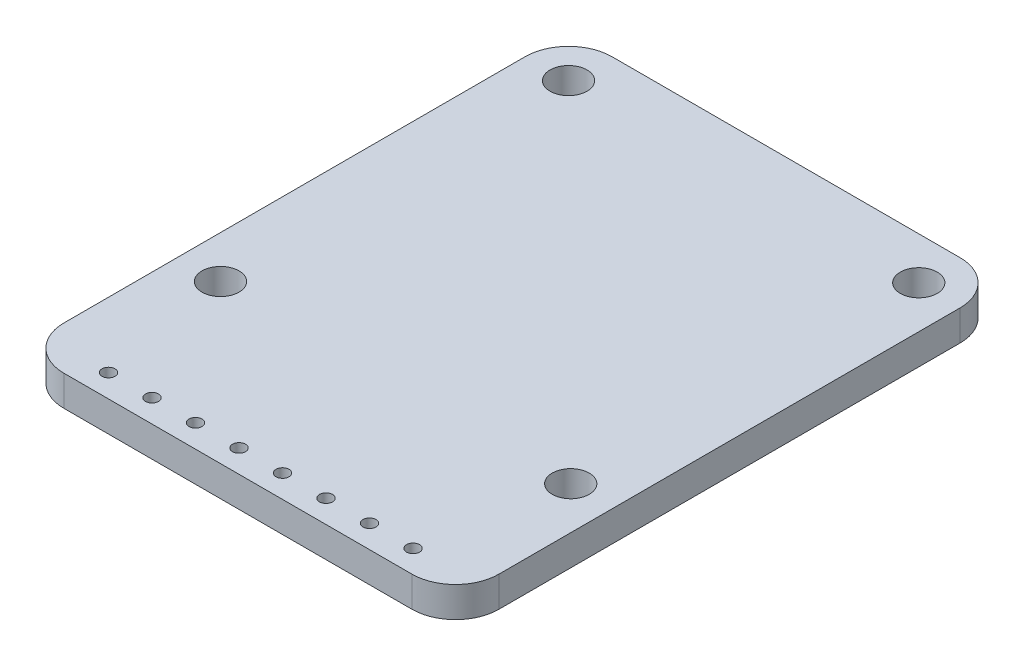
from build123d import *

# Parameters (mm, degrees)
SKETCH1_R           = 1.0795
BOSS_EXTRUDE1_DEPTH = 1.778
SKETCH2_W           = 13.208
SKETCH2_H           = 2.667
BOSS_EXTRUDE2_DEPTH = 2.159
SKETCH3_R           = 0.381
CUT_EXTRUDE1_DEPTH  = 21.805142946
SKETCH4_W           = 13.766930462
SKETCH4_H           = 3.870443226
CUT_EXTRUDE2_DEPTH  = 31.097928251
SKETCH5_W           = 0.284935897
SKETCH5_H           = 2.320192307
SKETCH5_W_2         = 1.221153846
SKETCH5_H_2         = 0.325641026
CUT_EXTRUDE3_DEPTH  = 0.0254
SKETCH9_W           = 14.097
SKETCH9_H           = 15.24
BOSS_EXTRUDE4_DEPTH = 1.524


with BuildPart() as part:
    # Sketch1 → Boss-Extrude1 (new body)
    with BuildSketch(Plane(origin=(0, 0, 0), x_dir=(1, 0, 0), z_dir=(0, 1, 0))):
        with BuildLine():
            Line((10.16, 16.002), (-10.16, 16.002))
            ThreePointArc((-10.16, 16.002), (-11.956051224, 15.258051224), (-12.7, 13.462))
            Line((-12.7, 13.462), (-12.7, -13.462))
            ThreePointArc((-12.7, -13.462), (-11.956051224, -15.258051224), (-10.16, -16.002))
            Line((-10.16, -16.002), (10.16, -16.002))
            ThreePointArc((10.16, -16.002), (11.956051224, -15.258051224), (12.7, -13.462))
            Line((12.7, -13.462), (12.7, 13.462))
            ThreePointArc((12.7, 13.462), (11.956051224, 15.258051224), (10.16, 16.002))
        make_face()
        with Locations(Location((-10.2235, 13.5255, 0), (0, 0, 270))):
            Circle(SKETCH1_R, mode=Mode.SUBTRACT)
        with Locations(Location((10.2235, 13.5255, 0), (0, 0, 270))):
            Circle(SKETCH1_R, mode=Mode.SUBTRACT)
        with Locations(Location((-10.2235, -6.7945, 0), (0, 0, 270))):
            Circle(SKETCH1_R, mode=Mode.SUBTRACT)
        with Locations(Location((10.2235, -6.7945, 0), (0, 0, 270))):
            Circle(SKETCH1_R, mode=Mode.SUBTRACT)
    extrude(amount=BOSS_EXTRUDE1_DEPTH)

    # Sketch2 → Boss-Extrude2 (add)
    with BuildSketch(Plane.XZ):
        with Locations((0, 14.6685)):
            Rectangle(SKETCH2_W, SKETCH2_H)
    extrude(amount=BOSS_EXTRUDE2_DEPTH)

    # Sketch3 → Cut-Extrude1 (cut, through all)
    with BuildSketch(Plane.XZ.offset(2.159)):
        with Locations(Location((-8.89, 14.6685, 0), (0, 0, 270))):
            Circle(SKETCH3_R)
        with Locations(Location((-6.35, 14.6685, 0), (0, 0, 270))):
            Circle(SKETCH3_R)
        with Locations(Location((-3.81, 14.6685, 0), (0, 0, 270))):
            Circle(SKETCH3_R)
        with Locations(Location((6.35, 14.6685, 0), (0, 0, 270))):
            Circle(SKETCH3_R)
        with Locations(Location((8.89, 14.6685, 0), (0, 0, 270))):
            Circle(SKETCH3_R)
        with Locations(Location((-1.27, 14.6685, 0), (0, 0, 270))):
            Circle(SKETCH3_R)
        with Locations(Location((1.27, 14.6685, 0), (0, 0, 270))):
            Circle(SKETCH3_R)
        with Locations(Location((3.81, 14.6685, 0), (0, 0, 270))):
            Circle(SKETCH3_R)
    extrude(amount=-CUT_EXTRUDE1_DEPTH, mode=Mode.SUBTRACT)

    # Sketch4 → Cut-Extrude2 (cut, through all)
    with BuildSketch(Plane.ZY.offset(12.7)):
        with Locations((10.251270415, -1.935221613)):
            Rectangle(SKETCH4_W, SKETCH4_H)
    extrude(amount=-CUT_EXTRUDE2_DEPTH, mode=Mode.SUBTRACT)

    # Sketch5 → Cut-Extrude3 (cut)
    # profile 1 of 9: a face of its own
    with BuildSketch(Plane.XZ):
        Polygon((-9.854352926, 0.17008141), (-9.435217309, 3.34508141), (-9.394512181, 3.34508141), (-8.083679849, 0.739953204), (-6.776027605, 3.34508141), (-6.73468646, 3.34508141), (-6.313006772, 0.17008141), (-6.599214705, 0.17008141), (-6.903231131, 2.45465673), (-8.049334897, 0.17008141), (-8.113572677, 0.17008141), (-9.264128567, 2.459744871), (-9.567508976, 0.17008141), align=None)
    # profile 2 of 9: a face of its own
    with BuildSketch(Plane.XZ):
        with BuildLine():
            add(Edge.make_bspline(
                [(-5.642644192, 3.467196794), (-5.624962784, 3.466376599), (-5.590339191, 3.464770499), (-5.540271013, 3.451016873), (-5.494680723, 3.427703587), (-5.454242351, 3.396425591), (-5.419542426, 3.359641453), (-5.395248495, 3.316769003), (-5.379634393, 3.270451523), (-5.377748847, 3.23814355), (-5.376788823, 3.22169399)],
                knots=[0, 0, 0, 0, 1.055194115, 2.066272739, 3.074728998, 4.095836921, 5.109056067, 6.073838105, 7.019297344, 8, 8, 8, 8], degree=3))
            add(Edge.make_bspline(
                [(-5.376788823, 3.22169399), (-5.377770497, 3.20567144), (-5.379711149, 3.173996756), (-5.395236435, 3.128482249), (-5.419749465, 3.086205506), (-5.454220101, 3.04949279), (-5.494686619, 3.018232085), (-5.540269447, 2.994914215), (-5.590339603, 2.981161804), (-5.624962923, 2.979555537), (-5.642644192, 2.978735256)],
                knots=[0, 0, 0, 0, 0.96129708, 1.900370562, 2.859976407, 3.87933698, 4.906634145, 5.921202961, 6.938410037, 8, 8, 8, 8], degree=3))
            add(Edge.make_bspline(
                [(-5.642644192, 2.978735256), (-5.66012327, 2.979524216), (-5.694144012, 2.981059825), (-5.743462505, 2.995184055), (-5.788664063, 3.018240064), (-5.829181302, 3.049288104), (-5.862954406, 3.086430975), (-5.887536458, 3.128456448), (-5.903025888, 3.174003324), (-5.904971372, 3.205673647), (-5.90595549, 3.22169399)],
                knots=[0, 0, 0, 0, 1.054934014, 2.053291228, 3.073705704, 4.106921865, 5.123545215, 6.088680038, 7.033164197, 8, 8, 8, 8], degree=3))
            add(Edge.make_bspline(
                [(-5.90595549, 3.22169399), (-5.904992933, 3.23814126), (-5.90310241, 3.270444738), (-5.887524847, 3.316795232), (-5.863159165, 3.359414166), (-5.829158939, 3.396630155), (-5.788670014, 3.427695656), (-5.743460967, 3.450747046), (-5.694144418, 3.464872476), (-5.660123408, 3.466407919), (-5.642644192, 3.467196794)],
                knots=[0, 0, 0, 0, 0.98631895, 1.937192651, 2.907499808, 3.917963147, 4.944918757, 5.95915025, 6.951458133, 8, 8, 8, 8], degree=3))
        make_face()
    # profile 3 of 9: a face of its own
    with BuildSketch(Plane.XZ):
        with Locations((-5.641372157, 1.330177563)):
            Rectangle(SKETCH5_W, SKETCH5_H)
    # profile 4 of 9: a face of its own
    with BuildSketch(Plane.XZ):
        with BuildLine():
            Line((-2.527429849, 1.987183773), (-2.76593646, 1.838991666))
            add(Edge.make_bspline(
                [(-2.76593646, 1.838991666), (-2.792089266, 1.871493138), (-2.843566625, 1.935466766), (-2.93295579, 2.018025777), (-3.028216144, 2.088934451), (-3.130975516, 2.146722853), (-3.241089777, 2.19137374), (-3.358124678, 2.222969713), (-3.482063529, 2.242658561), (-3.567031245, 2.244896335), (-3.61056787, 2.246042948)],
                knots=[0, 0, 0, 0, 1.026593902, 2.0206758, 2.988051866, 3.946915611, 4.916868779, 5.907761954, 6.927957743, 8, 8, 8, 8], degree=3))
            add(Edge.make_bspline(
                [(-3.61056787, 2.246042948), (-3.645364924, 2.245084241), (-3.713896775, 2.243196094), (-3.8145045, 2.231393718), (-3.910337206, 2.209947039), (-4.001995563, 2.181688671), (-4.088827657, 2.143815194), (-4.17106099, 2.097723487), (-4.24942497, 2.044156664), (-4.321648729, 1.982098527), (-4.387715042, 1.914608307), (-4.444954771, 1.842260312), (-4.494790418, 1.767221553), (-4.533893678, 1.687618187), (-4.565893297, 1.605271339), (-4.586945108, 1.518626627), (-4.600973796, 1.428794077), (-4.60257883, 1.367545297), (-4.603391387, 1.33653774)],
                knots=[0, 0, 0, 0, 1.112346261, 2.190735716, 3.231507886, 4.247384806, 5.251966152, 6.253067467, 7.256802811, 8.280671706, 9.291813951, 10.270744147, 11.225547591, 12.165006084, 13.100104208, 14.043489273, 15.009504848, 16, 16, 16, 16], degree=3))
            add(Edge.make_bspline(
                [(-4.603391387, 1.33653774), (-4.601777351, 1.29592567), (-4.598571027, 1.215248742), (-4.573441846, 1.09616075), (-4.532307991, 0.981022831), (-4.476012655, 0.870652449), (-4.404822683, 0.768513465), (-4.321209001, 0.676907046), (-4.225125261, 0.59760822), (-4.117418075, 0.531865287), (-4.000616408, 0.479013904), (-3.875983956, 0.441360823), (-3.744539155, 0.418634742), (-3.654544463, 0.415771851), (-3.608659817, 0.414312179)],
                knots=[0, 0, 0, 0, 0.966302908, 1.919585723, 2.883856336, 3.870342332, 4.860282998, 5.839159637, 6.814385684, 7.815993281, 8.834850808, 9.858348828, 10.908058873, 12, 12, 12, 12], degree=3))
            add(Edge.make_bspline(
                [(-3.608659817, 0.414312179), (-3.566609042, 0.415491008), (-3.483968112, 0.417807721), (-3.36316636, 0.437337567), (-3.24815887, 0.469308577), (-3.138949728, 0.513892517), (-3.035738492, 0.571521049), (-2.939192026, 0.642604011), (-2.847389225, 0.725096499), (-2.793416967, 0.788884944), (-2.76593646, 0.821363461)],
                knots=[0, 0, 0, 0, 1.039848629, 2.043578496, 3.018386758, 3.987534228, 4.954977003, 5.934852016, 6.948509513, 8, 8, 8, 8], degree=3))
            Line((-2.76593646, 0.821363461), (-2.527429849, 0.664903124))
            add(Edge.make_bspline(
                [(-2.527429849, 0.664903124), (-2.541570122, 0.644137965), (-2.569803734, 0.602676568), (-2.617000223, 0.544216548), (-2.667908927, 0.489496165), (-2.722331236, 0.438588768), (-2.779556538, 0.390276136), (-2.841539713, 0.346867922), (-2.906282147, 0.30592419), (-2.974543882, 0.269082513), (-3.045619159, 0.235966065), (-3.119407963, 0.207489788), (-3.195589651, 0.183024049), (-3.274253792, 0.163577313), (-3.355555471, 0.148055339), (-3.439284425, 0.137755909), (-3.525411817, 0.130067618), (-3.583625126, 0.129608725), (-3.61311194, 0.129376281)],
                knots=[0, 0, 0, 0, 0.954134338, 1.905101784, 2.851144739, 3.791306361, 4.734911809, 5.6936923, 6.663572882, 7.643865596, 8.638447847, 9.640600242, 10.646758161, 11.676244097, 12.717260333, 13.78922464, 14.880174919, 16, 16, 16, 16], degree=3))
            add(Edge.make_bspline(
                [(-3.61311194, 0.129376281), (-3.658116099, 0.1301848), (-3.746324577, 0.131769501), (-3.875431423, 0.149194332), (-3.99881525, 0.175463027), (-4.116433903, 0.213167271), (-4.228305694, 0.261703746), (-4.334326309, 0.320991804), (-4.434144696, 0.391523785), (-4.526773764, 0.472044297), (-4.611846933, 0.559348307), (-4.684895691, 0.653555018), (-4.748255329, 0.751200826), (-4.799134744, 0.854442325), (-4.839635884, 0.961907341), (-4.867308125, 1.074456773), (-4.885205816, 1.191162747), (-4.887277167, 1.270749004), (-4.888327285, 1.311097035)],
                knots=[0, 0, 0, 0, 1.1129367, 2.181364009, 3.217532258, 4.231199276, 5.232079859, 6.230262199, 7.231623845, 8.250719726, 9.263571943, 10.242672461, 11.195837495, 12.138959767, 13.085126421, 14.0317438, 15.002148558, 16, 16, 16, 16], degree=3))
            add(Edge.make_bspline(
                [(-4.888327285, 1.311097035), (-4.88792722, 1.338473186), (-4.887131426, 1.392928869), (-4.87800382, 1.473750823), (-4.866212348, 1.553496432), (-4.846231858, 1.631154863), (-4.82315357, 1.707903947), (-4.793693624, 1.782818618), (-4.759135658, 1.856247), (-4.719899963, 1.92799994), (-4.675732316, 1.996897022), (-4.62685434, 2.061987847), (-4.575106978, 2.124054348), (-4.518069362, 2.18095376), (-4.458161962, 2.23496159), (-4.39368989, 2.284635032), (-4.325022938, 2.330120074), (-4.253192353, 2.37225778), (-4.178239936, 2.409776697), (-4.100618742, 2.442101134), (-4.020796494, 2.46972597), (-3.938645507, 2.491596204), (-3.854711049, 2.509936296), (-3.768331693, 2.521473199), (-3.679837891, 2.529625032), (-3.619915642, 2.530523822), (-3.589579288, 2.530978845)],
                knots=[0, 0, 0, 0, 0.990994727, 1.971252077, 2.943264845, 3.907940874, 4.872158414, 5.844625996, 6.82015047, 7.809835459, 8.804511986, 9.781214284, 10.756496977, 11.728388426, 12.696359165, 13.676225489, 14.672885716, 15.677705647, 16.690706858, 17.706033469, 18.721040654, 19.747369689, 20.783475414, 21.830280724, 22.901553713, 24, 24, 24, 24], degree=3))
            add(Edge.make_bspline(
                [(-3.589579288, 2.530978845), (-3.551588047, 2.530142559), (-3.475795463, 2.528474165), (-3.363363537, 2.514432816), (-3.252587611, 2.493263353), (-3.14541131, 2.461900857), (-3.043134115, 2.423924541), (-2.947398385, 2.381277293), (-2.860457719, 2.331752188), (-2.780694835, 2.277577513), (-2.707960558, 2.216471549), (-2.641508269, 2.147703809), (-2.579975272, 2.071632188), (-2.545089541, 2.015565561), (-2.527429849, 1.987183773)],
                knots=[0, 0, 0, 0, 1.095225653, 2.184976855, 3.262915854, 4.344593502, 5.400796181, 6.407717688, 7.363229445, 8.282371371, 9.184954523, 10.097238608, 11.036792983, 12, 12, 12, 12], degree=3))
        make_face()
    # profile 5 of 9: a face of its own
    with BuildSketch(Plane.XZ):
        with BuildLine():
            Line((-2.03896831, 2.490273717), (-1.754032413, 2.490273717))
            Line((-1.754032413, 2.490273717), (-1.754032413, 2.148732251))
            add(Edge.make_bspline(
                [(-1.754032413, 2.148732251), (-1.732996896, 2.180532895), (-1.692766634, 2.24135138), (-1.625898476, 2.321787103), (-1.557406169, 2.388385038), (-1.48696182, 2.441456088), (-1.414047401, 2.481200845), (-1.340263166, 2.510313813), (-1.264448276, 2.527528949), (-1.213501387, 2.52982734), (-1.187976724, 2.530978845)],
                knots=[0, 0, 0, 0, 1.2804753, 2.448899062, 3.506932113, 4.484331642, 5.4025378, 6.288909075, 7.142734305, 8, 8, 8, 8], degree=3))
            add(Edge.make_bspline(
                [(-1.187976724, 2.530978845), (-1.168177128, 2.529898868), (-1.127438172, 2.527676744), (-1.065768251, 2.512064067), (-1.002228834, 2.487137575), (-0.96127824, 2.463696802), (-0.939929849, 2.451476642)],
                knots=[0, 0, 0, 0, 0.901110191, 1.854092781, 2.881294221, 4, 4, 4, 4], degree=3))
            Line((-0.939929849, 2.451476642), (-1.096390185, 2.204701802))
            add(Edge.make_bspline(
                [(-1.096390185, 2.204701802), (-1.110096226, 2.210816186), (-1.136112915, 2.222422458), (-1.1741717, 2.236158425), (-1.209261198, 2.244246434), (-1.231616426, 2.245471728), (-1.242038222, 2.246042948)],
                knots=[0, 0, 0, 0, 1.180555205, 2.24091978, 3.179933427, 4, 4, 4, 4], degree=3))
            add(Edge.make_bspline(
                [(-1.242038222, 2.246042948), (-1.264903423, 2.244518914), (-1.311541806, 2.241410327), (-1.38001703, 2.21697298), (-1.44646271, 2.177489369), (-1.499232717, 2.133700575), (-1.540092475, 2.091475073), (-1.569248251, 2.054601165), (-1.595993315, 2.013254835), (-1.621547729, 1.968142907), (-1.644830724, 1.918495118), (-1.666561032, 1.864807489), (-1.686208714, 1.807017836), (-1.69741215, 1.76675655), (-1.703151003, 1.746133092)],
                knots=[0, 0, 0, 0, 1.125678352, 2.296057538, 3.5422874, 4.923748041, 5.663163013, 6.437101912, 7.23742474, 8.08941207, 8.991984279, 9.93940061, 10.944477711, 12, 12, 12, 12], degree=3))
            add(Edge.make_bspline(
                [(-1.703151003, 1.746133092), (-1.70744396, 1.727738799), (-1.716952533, 1.686996837), (-1.726197714, 1.618644961), (-1.735332205, 1.537887785), (-1.741769852, 1.444500519), (-1.747737075, 1.338716373), (-1.75110265, 1.220374194), (-1.753917642, 1.089352511), (-1.753992995, 0.997754348), (-1.754032413, 0.949839022)],
                knots=[0, 0, 0, 0, 0.566838948, 1.255505196, 2.06880316, 3.007127437, 4.065329342, 5.249902469, 6.561414163, 8, 8, 8, 8], degree=3))
            Line((-1.754032413, 0.949839022), (-1.754032413, 0.17008141))
            Line((-1.754032413, 0.17008141), (-2.03896831, 0.17008141))
            Line((-2.03896831, 0.17008141), (-2.03896831, 2.490273717))
        make_face()
    # profile 6 of 9: a face of its own
    with BuildSketch(Plane.XZ):
        with BuildLine():
            add(Edge.make_bspline(
                [(0.465669109, 2.530978845), (0.50920405, 2.530051844), (0.594565428, 2.528234221), (0.719576868, 2.508807788), (0.838907098, 2.479101251), (0.953013144, 2.438033476), (1.060433641, 2.382986278), (1.162733269, 2.317300707), (1.259631556, 2.23948364), (1.317709589, 2.179287392), (1.347189542, 2.148732251)],
                knots=[0, 0, 0, 0, 1.054011418, 2.066658804, 3.057071809, 4.030435133, 4.997543892, 5.974964718, 6.972108034, 8, 8, 8, 8], degree=3))
            add(Edge.make_bspline(
                [(1.347189542, 2.148732251), (1.372573172, 2.119509564), (1.422849188, 2.061629729), (1.487315947, 1.967780709), (1.542852648, 1.870589332), (1.587359763, 1.768764971), (1.622452606, 1.66319652), (1.647367916, 1.553521124), (1.66218785, 1.439980994), (1.664186256, 1.36287037), (1.665198356, 1.323817387)],
                knots=[0, 0, 0, 0, 1.025258237, 2.030674902, 3.01204498, 3.988269485, 4.97094183, 5.956517959, 6.965070386, 8, 8, 8, 8], degree=3))
            add(Edge.make_bspline(
                [(1.665198356, 1.323817387), (1.664308143, 1.284538049), (1.66254904, 1.206920245), (1.64590876, 1.092602678), (1.620026989, 0.981754517), (1.582986679, 0.874839845), (1.535490394, 0.771531852), (1.477532413, 0.67228176), (1.408706017, 0.576893754), (1.330688106, 0.486177801), (1.244462476, 0.402569877), (1.150921398, 0.329700661), (1.051903096, 0.267269707), (0.946090911, 0.216980958), (0.83445112, 0.177330016), (0.716742922, 0.149480715), (0.59314918, 0.132642617), (0.508760201, 0.130480375), (0.465669109, 0.129376281)],
                knots=[0, 0, 0, 0, 0.998656419, 1.973391657, 2.932242238, 3.890759089, 4.846373663, 5.82037756, 6.809684879, 7.83454468, 8.860553229, 9.859544525, 10.845671541, 11.83227036, 12.833544569, 13.85385346, 14.904124723, 16, 16, 16, 16], degree=3))
            add(Edge.make_bspline(
                [(0.465669109, 0.129376281), (0.4223669, 0.130484081), (0.337557334, 0.132653762), (0.213527336, 0.149415297), (0.095608182, 0.177317181), (-0.016177761, 0.217111264), (-0.122444872, 0.267271314), (-0.222036909, 0.329511918), (-0.315653975, 0.402591488), (-0.401897847, 0.486171945), (-0.479910867, 0.576895263), (-0.548738525, 0.672281369), (-0.606696178, 0.771531954), (-0.654192548, 0.874839818), (-0.691232836, 0.981754525), (-0.717114613, 1.092602676), (-0.733754892, 1.206920246), (-0.735513995, 1.284538049), (-0.736404208, 1.323817387)],
                knots=[0, 0, 0, 0, 1.099876186, 2.154163076, 3.173186993, 4.173200201, 5.163417411, 6.152872554, 7.150605724, 8.17532212, 9.198891216, 10.186952605, 11.159729845, 12.11414092, 13.071450619, 14.029093627, 15.002601286, 16, 16, 16, 16], degree=3))
            add(Edge.make_bspline(
                [(-0.736404208, 1.323817387), (-0.735385205, 1.362658111), (-0.733367754, 1.439556069), (-0.718562721, 1.55288276), (-0.693744602, 1.662372534), (-0.658609692, 1.767533501), (-0.613692341, 1.868911647), (-0.558936029, 1.966343172), (-0.49381167, 2.05976782), (-0.443735614, 2.11757285), (-0.418395394, 2.146824198)],
                knots=[0, 0, 0, 0, 1.031353054, 2.041901799, 3.029428768, 4.008703097, 4.981709435, 5.96992636, 6.972712378, 8, 8, 8, 8], degree=3))
            add(Edge.make_bspline(
                [(-0.418395394, 2.146824198), (-0.388959886, 2.177644322), (-0.331069781, 2.238257517), (-0.23368915, 2.315847736), (-0.131641183, 2.382900174), (-0.023033572, 2.436853598), (0.090978735, 2.479342825), (0.210920477, 2.508884399), (0.336356123, 2.528164228), (0.422135208, 2.53003129), (0.465669109, 2.530978845)],
                knots=[0, 0, 0, 0, 1.027980169, 2.021703884, 2.998553061, 3.971491411, 4.943284454, 5.930300938, 6.949603206, 8, 8, 8, 8], degree=3))
        make_face()
        with BuildLine():
            add(Edge.make_bspline(
                [(0.464397074, 2.246042948), (0.433610812, 2.245167926), (0.372833031, 2.243440469), (0.28337098, 2.230301499), (0.197246697, 2.209484834), (0.114296788, 2.179908297), (0.034800982, 2.141718582), (-0.041316833, 2.094811712), (-0.114280546, 2.039808959), (-0.182662847, 1.976796393), (-0.245421087, 1.907963305), (-0.300283251, 1.834622293), (-0.346933169, 1.757962965), (-0.385795314, 1.677905602), (-0.414739691, 1.593638912), (-0.435760933, 1.506117197), (-0.448887508, 1.41516214), (-0.450598723, 1.35333036), (-0.45146831, 1.321909334)],
                knots=[0, 0, 0, 0, 1.021534396, 2.016698045, 2.994645724, 3.958388632, 4.93408049, 5.916473867, 6.921342795, 7.962252576, 8.998418191, 10.008913653, 10.997312074, 11.973003931, 12.956656626, 13.948281152, 14.957379055, 16, 16, 16, 16], degree=3))
            add(Edge.make_bspline(
                [(-0.45146831, 1.321909334), (-0.450010692, 1.281312853), (-0.447117592, 1.200736427), (-0.423590627, 1.082072052), (-0.384233073, 0.968151372), (-0.331086041, 0.859642222), (-0.264496114, 0.759246655), (-0.186039989, 0.669737523), (-0.09655969, 0.592461823), (0.002878136, 0.528344198), (0.11024241, 0.477399277), (0.223867787, 0.441295921), (0.342377559, 0.4178266), (0.423367937, 0.415493905), (0.464397074, 0.414312179)],
                knots=[0, 0, 0, 0, 1.016792936, 2.018143844, 3.017858371, 4.030088057, 5.03801393, 6.028138512, 7.003788237, 7.991172063, 8.984598303, 9.972568034, 10.972917682, 12, 12, 12, 12], degree=3))
            add(Edge.make_bspline(
                [(0.464397074, 0.414312179), (0.505423852, 0.41550079), (0.586409571, 0.417847076), (0.704754681, 0.44117772), (0.818069499, 0.477557469), (0.925322257, 0.528286902), (1.024714819, 0.592705307), (1.114838665, 0.669301163), (1.192624905, 0.759483729), (1.259148961, 0.859775201), (1.313166363, 0.967983149), (1.352339696, 1.082093078), (1.37592322, 1.200731073), (1.378808687, 1.281311059), (1.380262459, 1.321909334)],
                knots=[0, 0, 0, 0, 1.02726834, 2.027799167, 3.010890988, 4.004497153, 4.992059811, 5.971914811, 6.958719428, 7.966827853, 8.981595046, 9.981490638, 10.983022906, 12, 12, 12, 12], degree=3))
            add(Edge.make_bspline(
                [(1.380262459, 1.321909334), (1.379393171, 1.353330547), (1.377682545, 1.415162698), (1.364551685, 1.506115066), (1.343546302, 1.593646729), (1.314543478, 1.677876761), (1.275850194, 1.758170247), (1.228300675, 1.834397213), (1.17366253, 1.908217366), (1.110146999, 1.976573883), (1.041836078, 2.039833523), (0.968842793, 2.094833041), (0.892837848, 2.141512431), (0.813572991, 2.180234949), (0.730612448, 2.209215751), (0.644608838, 2.230421695), (0.555528489, 2.243384945), (0.494968499, 2.24515128), (0.464397074, 2.246042948)],
                knots=[0, 0, 0, 0, 1.042956736, 2.052379634, 3.044323526, 4.02829302, 5.004299113, 5.996692471, 7.007513377, 8.048758398, 9.090003419, 10.095195979, 11.07790575, 12.047570684, 13.018257071, 13.989683339, 14.985167495, 16, 16, 16, 16], degree=3))
        make_face(mode=Mode.SUBTRACT)
    # profile 7 of 9: a face of its own
    with BuildSketch(Plane.XZ):
        with Locations((2.642121433, 1.391235256)):
            Rectangle(SKETCH5_W_2, SKETCH5_H_2)
    # profile 8 of 9: a face of its own
    with BuildSketch(Plane.XZ):
        with BuildLine():
            Line((3.456223997, 0.782566386), (3.724623436, 0.943478845))
            add(Edge.make_bspline(
                [(3.724623436, 0.943478845), (3.749586409, 0.901691868), (3.7974145, 0.821629631), (3.877198948, 0.713445551), (3.959869517, 0.621495595), (4.046038412, 0.546314672), (4.135179665, 0.487124611), (4.2278752, 0.445212586), (4.323812642, 0.41907238), (4.389103181, 0.415897302), (4.421698757, 0.414312179)],
                knots=[0, 0, 0, 0, 1.272034388, 2.437168799, 3.508375237, 4.49857839, 5.41946034, 6.295179144, 7.148887113, 8, 8, 8, 8], degree=3))
            add(Edge.make_bspline(
                [(4.421698757, 0.414312179), (4.449536123, 0.415087489), (4.504723767, 0.416624543), (4.585969516, 0.431393556), (4.664874437, 0.45408313), (4.739812273, 0.486577832), (4.809749009, 0.52589203), (4.871077939, 0.573377491), (4.924096913, 0.626541692), (4.96746661, 0.6858531), (5.000740642, 0.749640799), (5.026314876, 0.815114698), (5.040507193, 0.883303328), (5.042645105, 0.929214248), (5.043723997, 0.952383092)],
                knots=[0, 0, 0, 0, 1.095163259, 2.171163733, 3.241058638, 4.321873601, 5.38011039, 6.391990106, 7.366004449, 8.327778327, 9.272591725, 10.192022065, 11.087607919, 12, 12, 12, 12], degree=3))
            add(Edge.make_bspline(
                [(5.043723997, 0.952383092), (5.042386587, 0.978818006), (5.039667827, 1.032556323), (5.016688556, 1.111840293), (4.980539596, 1.190301411), (4.947190626, 1.238834701), (4.929876842, 1.26403173)],
                knots=[0, 0, 0, 0, 0.938893495, 1.908633276, 2.914225137, 4, 4, 4, 4], degree=3))
            add(Edge.make_bspline(
                [(4.929876842, 1.26403173), (4.915661356, 1.282217063), (4.885817722, 1.320394895), (4.834511978, 1.377223072), (4.774308432, 1.43584121), (4.70726735, 1.49848764), (4.630946619, 1.562248713), (4.54773666, 1.630164936), (4.455513016, 1.69965351), (4.390834187, 1.746255765), (4.357460976, 1.770301762)],
                knots=[0, 0, 0, 0, 0.722233717, 1.516239348, 2.393582979, 3.351407094, 4.387010283, 5.505090956, 6.712668013, 8, 8, 8, 8], degree=3))
            add(Edge.make_bspline(
                [(4.357460976, 1.770301762), (4.324056351, 1.794094838), (4.260189252, 1.839585387), (4.170873252, 1.907098845), (4.091004346, 1.968824355), (4.020937524, 2.025342995), (3.960703604, 2.076662429), (3.909827939, 2.122289845), (3.869606533, 2.163459218), (3.847240399, 2.190166721), (3.837198557, 2.202157732)],
                knots=[0, 0, 0, 0, 1.452282411, 2.77665338, 3.964542531, 5.026858415, 5.96415736, 6.766646006, 7.446254459, 8, 8, 8, 8], degree=3))
            add(Edge.make_bspline(
                [(3.837198557, 2.202157732), (3.823162748, 2.220845815), (3.795559446, 2.257598439), (3.759123141, 2.315043132), (3.728154043, 2.373847094), (3.703876785, 2.434168342), (3.683433215, 2.495160028), (3.669682806, 2.557617944), (3.661072753, 2.621261833), (3.660191023, 2.664091223), (3.659749638, 2.685531129)],
                knots=[0, 0, 0, 0, 1.068054152, 2.10047183, 3.106115577, 4.101338837, 5.06977816, 6.043150881, 7.020423561, 8, 8, 8, 8], degree=3))
            add(Edge.make_bspline(
                [(3.659749638, 2.685531129), (3.660933649, 2.719122425), (3.663276364, 2.785587025), (3.683088833, 2.882679279), (3.714360672, 2.975376957), (3.758171035, 3.062762331), (3.814647348, 3.142560043), (3.880003339, 3.215687991), (3.957846616, 3.277163777), (4.043256495, 3.330877573), (4.136743347, 3.372919948), (4.234706524, 3.404634551), (4.337301725, 3.422604378), (4.406791711, 3.425183172), (4.442051321, 3.426491666)],
                knots=[0, 0, 0, 0, 1.005424448, 1.989358655, 2.955360095, 3.929531133, 4.905563448, 5.876582895, 6.856512386, 7.866279853, 8.892233794, 9.918561126, 10.94386622, 12, 12, 12, 12], degree=3))
            add(Edge.make_bspline(
                [(4.442051321, 3.426491666), (4.479465612, 3.425201208), (4.553870695, 3.4226349), (4.663316769, 3.400321426), (4.768691134, 3.363400102), (4.853457524, 3.321500391), (4.919799386, 3.279652606), (4.970393222, 3.241534623), (5.021662624, 3.197651489), (5.074021145, 3.147886315), (5.1265816, 3.091782477), (5.180124303, 3.029724209), (5.234774462, 2.962090762), (5.269931563, 2.913808536), (5.287954766, 2.88905677)],
                knots=[0, 0, 0, 0, 1.286793592, 2.559021753, 3.825965368, 5.121522368, 5.803751409, 6.523245864, 7.299691795, 8.125521123, 9.008227632, 9.944561021, 10.946284179, 12, 12, 12, 12], degree=3))
            Line((5.287954766, 2.88905677), (5.030367627, 2.693799358))
            add(Edge.make_bspline(
                [(5.030367627, 2.693799358), (5.014813817, 2.713836956), (4.984860815, 2.752424684), (4.939386209, 2.806464378), (4.896524936, 2.855827899), (4.854297073, 2.898704122), (4.81493285, 2.937441057), (4.776726676, 2.970605979), (4.740228372, 2.998523841), (4.694220889, 3.028317642), (4.636419816, 3.057851041), (4.563862415, 3.082841991), (4.488037722, 3.097859797), (4.436394414, 3.099845431), (4.41025044, 3.10085064)],
                knots=[0, 0, 0, 0, 1.181633172, 2.275549214, 3.290209073, 4.226197932, 5.078386478, 5.862611352, 6.581680152, 7.217281963, 8.414376989, 9.595101626, 10.782541182, 12, 12, 12, 12], degree=3))
            add(Edge.make_bspline(
                [(4.41025044, 3.10085064), (4.377451308, 3.099751455), (4.314201274, 3.097631781), (4.224402988, 3.074481508), (4.143582071, 3.038030821), (4.074137958, 2.986945091), (4.016319415, 2.926419619), (3.974495177, 2.856770229), (3.949321813, 2.779860478), (3.946249974, 2.726210547), (3.944685536, 2.698887499)],
                knots=[0, 0, 0, 0, 1.14458467, 2.207223713, 3.21896685, 4.227309161, 5.202851033, 6.127160689, 7.046193047, 8, 8, 8, 8], degree=3))
            add(Edge.make_bspline(
                [(3.944685536, 2.698887499), (3.945042158, 2.68187723), (3.945755985, 2.647828875), (3.955711694, 2.597526513), (3.9685018, 2.547351227), (3.988769759, 2.497528598), (4.016750855, 2.447187287), (4.053494836, 2.395460425), (4.099771198, 2.341892089), (4.135219631, 2.307051114), (4.153935335, 2.288656129)],
                knots=[0, 0, 0, 0, 0.858281714, 1.717966888, 2.583508476, 3.4729293, 4.427298488, 5.488583878, 6.674047936, 8, 8, 8, 8], degree=3))
            add(Edge.make_bspline(
                [(4.153935335, 2.288656129), (4.160885295, 2.28245397), (4.177396807, 2.26771906), (4.207582825, 2.243596062), (4.247445221, 2.213839262), (4.295943075, 2.177020767), (4.35397061, 2.134311155), (4.421534207, 2.086256521), (4.497880741, 2.031296855), (4.55205705, 1.992872515), (4.580703164, 1.972555368)],
                knots=[0, 0, 0, 0, 0.420754252, 0.999615792, 1.744751191, 2.668019286, 3.750313428, 4.999500688, 6.413464383, 8, 8, 8, 8], degree=3))
            add(Edge.make_bspline(
                [(4.580703164, 1.972555368), (4.615161814, 1.947480706), (4.681886214, 1.898927099), (4.77682559, 1.825978589), (4.86290783, 1.754633827), (4.940435164, 1.685348427), (5.010173503, 1.618647942), (5.071349149, 1.553729914), (5.124585445, 1.491059431), (5.181898022, 1.410711451), (5.240461187, 1.312031468), (5.290754554, 1.191129066), (5.322466769, 1.069756689), (5.326613787, 0.988180202), (5.328659895, 0.947930969)],
                knots=[0, 0, 0, 0, 1.163667725, 2.253281268, 3.268753668, 4.215851969, 5.092017293, 5.902905408, 6.650798638, 7.335211899, 8.59617414, 9.77448103, 10.901945474, 12, 12, 12, 12], degree=3))
            add(Edge.make_bspline(
                [(5.328659895, 0.947930969), (5.328063776, 0.919466309), (5.326883116, 0.863089754), (5.31331143, 0.780308363), (5.293427163, 0.699907503), (5.263457672, 0.622880993), (5.226878807, 0.547819673), (5.180463711, 0.476692506), (5.126663168, 0.407925273), (5.064946824, 0.343351677), (4.997413756, 0.284073342), (4.926036404, 0.23134198), (4.850697942, 0.187374286), (4.771807069, 0.151496022), (4.689345664, 0.123434903), (4.60334146, 0.103103229), (4.513652689, 0.090624834), (4.452692252, 0.08932965), (4.421698757, 0.088671153)],
                knots=[0, 0, 0, 0, 0.983748083, 1.948392443, 2.894712957, 3.844097841, 4.80183111, 5.778335162, 6.776009319, 7.81870978, 8.863265674, 9.881300176, 10.883814829, 11.87499822, 12.874611388, 13.892143829, 14.928324115, 16, 16, 16, 16], degree=3))
            add(Edge.make_bspline(
                [(4.421698757, 0.088671153), (4.397718124, 0.089134868), (4.350058871, 0.090056457), (4.279565269, 0.098203762), (4.210495785, 0.10973092), (4.143717114, 0.128031684), (4.078368891, 0.150235798), (4.014735328, 0.177575572), (3.952785587, 0.210339033), (3.892172494, 0.247799519), (3.833050207, 0.291394759), (3.775973261, 0.342170717), (3.719068928, 0.398726996), (3.66401679, 0.462599436), (3.609703295, 0.532756125), (3.557199309, 0.609853456), (3.505418037, 0.693471484), (3.472928291, 0.752313383), (3.456223997, 0.782566386)],
                knots=[0, 0, 0, 0, 0.915332311, 1.819136955, 2.706846663, 3.586547465, 4.459518054, 5.340707479, 6.227863349, 7.133153174, 8.059268498, 9.028702269, 10.047606654, 11.120612155, 12.245963614, 13.433783089, 14.680604001, 16, 16, 16, 16], degree=3))
        make_face()
    # profile 9 of 9: a face of its own
    with BuildSketch(Plane.XZ):
        with BuildLine():
            Line((5.979941946, 0.17008141), (5.979941946, 3.34508141))
            Line((5.979941946, 3.34508141), (6.621047715, 3.34508141))
            add(Edge.make_bspline(
                [(6.621047715, 3.34508141), (6.676808869, 3.344679935), (6.784539127, 3.343904289), (6.940216133, 3.338986313), (7.084255689, 3.33028639), (7.216184068, 3.317614035), (7.336363454, 3.302053783), (7.444457334, 3.282549844), (7.541024635, 3.259519147), (7.60041477, 3.239883631), (7.628499638, 3.230598237)],
                knots=[0, 0, 0, 0, 1.314313732, 2.53924729, 3.670748893, 4.714932338, 5.66265055, 6.526160246, 7.303039223, 8, 8, 8, 8], degree=3))
            add(Edge.make_bspline(
                [(7.628499638, 3.230598237), (7.665234152, 3.216600382), (7.737870162, 3.188922098), (7.841290909, 3.136710311), (7.938650345, 3.077552711), (8.030470569, 3.011371321), (8.114654176, 2.936292234), (8.194489911, 2.855504735), (8.266711839, 2.766071026), (8.332850079, 2.669845858), (8.392481713, 2.567962783), (8.444315092, 2.460615934), (8.487362643, 2.348350467), (8.523097927, 2.231478582), (8.551261499, 2.109743297), (8.570476537, 1.983002861), (8.583150221, 1.851758168), (8.584423896, 1.762699904), (8.585070151, 1.717512299)],
                knots=[0, 0, 0, 0, 0.984719456, 1.947108742, 2.898477687, 3.838006223, 4.779231079, 5.722358779, 6.681677486, 7.655904652, 8.64651281, 9.637519902, 10.640069247, 11.656948941, 12.698408672, 13.768548281, 14.867775369, 16, 16, 16, 16], degree=3))
            add(Edge.make_bspline(
                [(8.585070151, 1.717512299), (8.584499588, 1.678268176), (8.583375233, 1.600933531), (8.573279354, 1.48695929), (8.55860512, 1.376366265), (8.535886455, 1.269681094), (8.508307032, 1.165969068), (8.472960981, 1.066335532), (8.432470209, 0.969866505), (8.385253534, 0.877866366), (8.333418134, 0.790705021), (8.277790553, 0.708540078), (8.218430122, 0.632543984), (8.154770798, 0.5624866), (8.087635227, 0.498473539), (8.01658387, 0.439970068), (7.941433388, 0.388120908), (7.862520375, 0.340888603), (7.777542744, 0.299685852), (7.684890922, 0.264824343), (7.584169782, 0.235934913), (7.47562655, 0.211831315), (7.359073681, 0.19271119), (7.234396905, 0.179896534), (7.101787778, 0.171230659), (7.010729444, 0.170471931), (6.963861217, 0.17008141)],
                knots=[0, 0, 0, 0, 1.105936401, 2.179363191, 3.223086493, 4.248585256, 5.251745608, 6.245858792, 7.225916811, 8.198733463, 9.158002045, 10.082870192, 10.993790845, 11.873723703, 12.748670949, 13.606408763, 14.465103618, 15.319838547, 16.196477973, 17.123216899, 18.106603292, 19.147568657, 20.255746949, 21.433717677, 22.679120308, 24, 24, 24, 24], degree=3))
            Line((6.963861217, 0.17008141), (5.979941946, 0.17008141))
        make_face()
        with BuildLine():
            Line((6.264877843, 0.495722435), (6.629315944, 0.495722435))
            add(Edge.make_bspline(
                [(6.629315944, 0.495722435), (6.681683823, 0.495947494), (6.782406433, 0.496380365), (6.927239045, 0.500178756), (7.059572498, 0.506385371), (7.179425581, 0.515071334), (7.286730625, 0.526563578), (7.381711884, 0.539376883), (7.464058011, 0.555340284), (7.513886857, 0.569810083), (7.5369131, 0.576496674)],
                knots=[0, 0, 0, 0, 1.375205317, 2.645023457, 3.804390687, 4.853969522, 5.800190428, 6.637939096, 7.370582563, 8, 8, 8, 8], degree=3))
            add(Edge.make_bspline(
                [(7.5369131, 0.576496674), (7.565894828, 0.586703445), (7.623166057, 0.606873198), (7.705608184, 0.64366479), (7.782494896, 0.687245811), (7.855166133, 0.735689302), (7.922591028, 0.79070389), (7.985568619, 0.851093287), (8.04397211, 0.917164833), (8.097198089, 0.988836522), (8.144830622, 1.065662265), (8.186079523, 1.146886779), (8.222230556, 1.231620099), (8.250604707, 1.321163407), (8.272843845, 1.414716196), (8.288596097, 1.512285047), (8.298406597, 1.613851738), (8.299550911, 1.682932594), (8.300134254, 1.718148317)],
                knots=[0, 0, 0, 0, 0.998632004, 1.973411704, 2.929992603, 3.868527914, 4.809262121, 5.754881198, 6.702106254, 7.672490631, 8.653608572, 9.636854334, 10.631411391, 11.644891563, 12.686317036, 13.754757253, 14.855430412, 16, 16, 16, 16], degree=3))
            add(Edge.make_bspline(
                [(8.300134254, 1.718148317), (8.299668629, 1.755280831), (8.298753904, 1.828227984), (8.287256494, 1.9352624), (8.270454797, 2.038205562), (8.246158168, 2.137064353), (8.215196585, 2.232031644), (8.17655716, 2.3225822), (8.132409584, 2.409672331), (8.079882985, 2.491291934), (8.022355983, 2.56848354), (7.958513192, 2.639199785), (7.889368915, 2.703601758), (7.815677301, 2.76269242), (7.735361504, 2.814094469), (7.650313513, 2.860074529), (7.559285654, 2.899096088), (7.495955566, 2.919850485), (7.463771073, 2.930397916)],
                knots=[0, 0, 0, 0, 1.122418816, 2.205001699, 3.251619955, 4.274784885, 5.280384055, 6.268708349, 7.249350384, 8.229342522, 9.199999885, 10.157847722, 11.105861043, 12.055065948, 13.010012805, 13.98527497, 14.976112212, 16, 16, 16, 16], degree=3))
            add(Edge.make_bspline(
                [(7.463771073, 2.930397916), (7.43714539, 2.937760676), (7.380531883, 2.953415923), (7.28814894, 2.970493225), (7.184176626, 2.985555877), (7.068153326, 2.998308527), (6.940211295, 3.007459169), (6.800252135, 3.014327433), (6.648215351, 3.018959878), (6.542821196, 3.019276205), (6.488120031, 3.019440384)],
                knots=[0, 0, 0, 0, 0.674548936, 1.434276114, 2.292660221, 3.240891867, 4.284742987, 5.42552168, 6.663806718, 8, 8, 8, 8], degree=3))
            Line((6.488120031, 3.019440384), (6.264877843, 3.019440384))
            Line((6.264877843, 3.019440384), (6.264877843, 0.495722435))
        make_face(mode=Mode.SUBTRACT)
    extrude(amount=-CUT_EXTRUDE3_DEPTH, mode=Mode.SUBTRACT)

    # Sketch9 → Boss-Extrude4 (add)
    with BuildSketch(Plane.XZ):
        with Locations((0, -8.382)):
            Rectangle(SKETCH9_W, SKETCH9_H)
    extrude(amount=BOSS_EXTRUDE4_DEPTH)


solid = part.part
